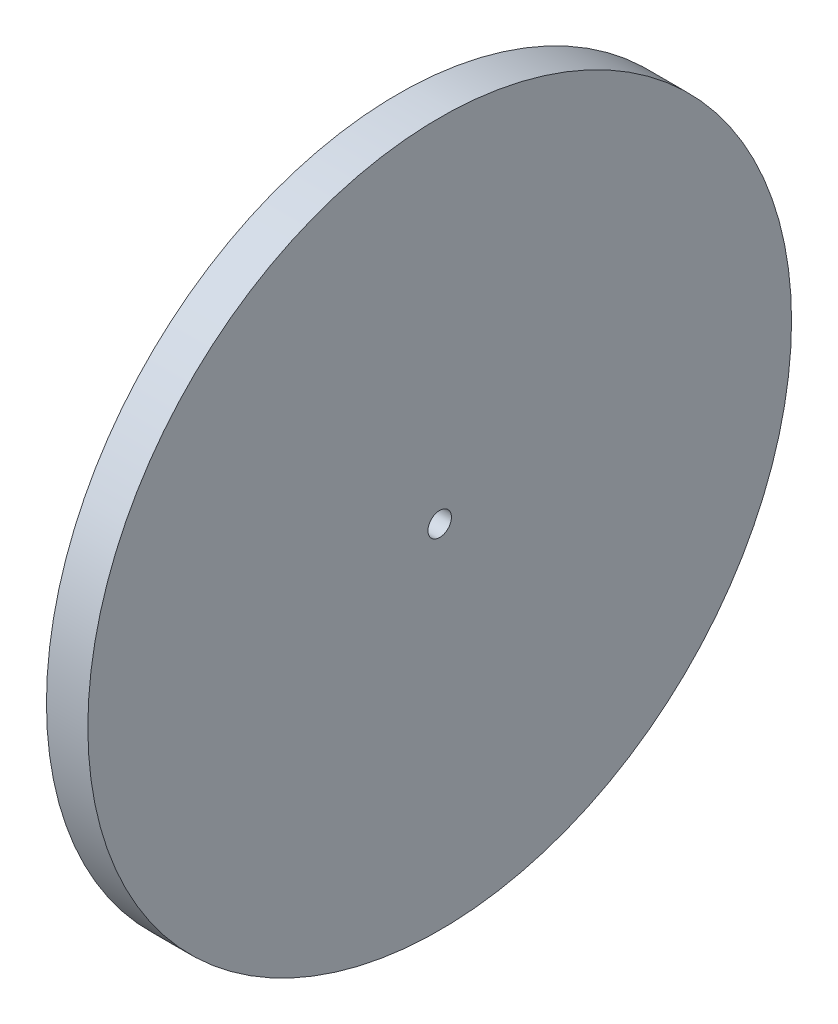
from build123d import *

# Parameters (mm, degrees)
SKETCH1_R      = 27
SKETCH1_R_2    = 0.9
EXTRUDE1_DEPTH = 3.175


with BuildPart() as part:
    # Sketch1 → Extrude1 (new body)
    with BuildSketch(Plane(origin=(0, 0, 0), x_dir=(0, 0, -1), z_dir=(1, 0, 0))):
        with Locations((-1.775910693, 2.66386604)):
            Circle(SKETCH1_R)
        with Locations((-1.775910693, 2.66386604)):
            Circle(SKETCH1_R_2, mode=Mode.SUBTRACT)
    extrude(amount=EXTRUDE1_DEPTH)


solid = part.part
